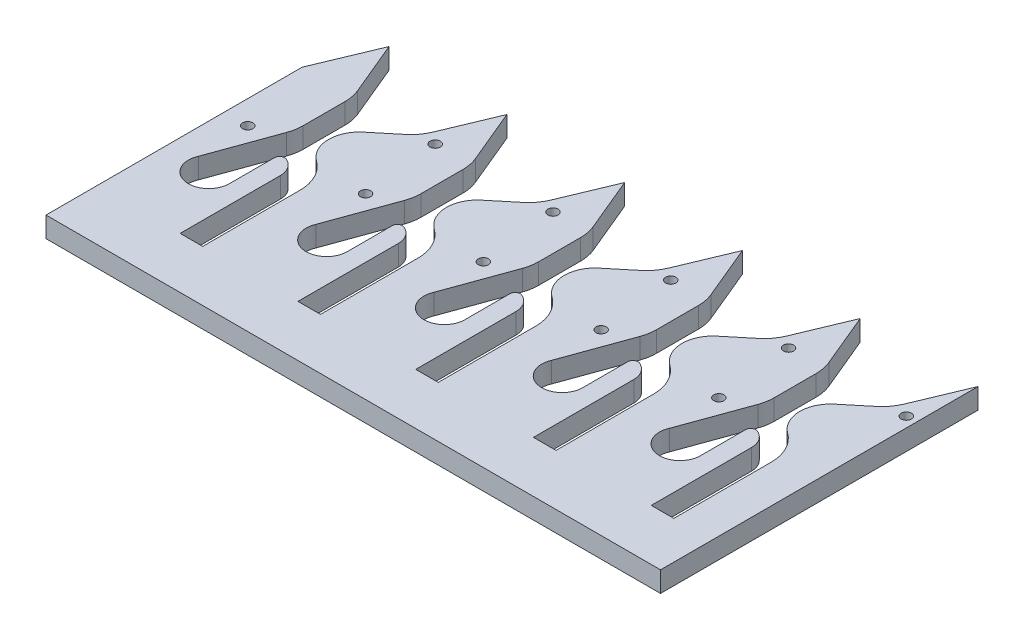
from build123d import *

# Parameters (mm, degrees)
SKETCH1_R           = 2.5
BOSS_EXTRUDE1_DEPTH = 10
FILLET1_R           = 20
FILLET2_R           = 2.5


with BuildPart() as part:
    # Sketch1 → Boss-Extrude1 (new body)
    with BuildSketch(Plane(origin=(0, 0, 0), x_dir=(1, 0, 0), z_dir=(0, 1, 0))):
        with BuildLine():
            Line((0, 0), (-300, 0))
            Line((-300, 0), (-300, 125))
            Line((-300, 125), (-287.5, 155))
            Line((-287.5, 155), (-275, 125))
            Line((-275, 125), (-275, 97))
            Line((-275, 97), (-287.66515139, 62))
            ThreePointArc((-287.66515139, 62), (-280.543096437, 48.210936871), (-268.5, 58))
            Line((-268.5, 58), (-268.5, 83))
            ThreePointArc((-268.5, 83), (-262.136038969, 80.363961031), (-259.5, 74))
            Line((-259.5, 74), (-259.5, 25))
            Line((-259.5, 25), (-248.5, 25))
            Line((-248.5, 25), (-248.5, 86.008335649))
            ThreePointArc((-248.5, 86.008335649), (-262.197622342, 96.159801673), (-257.553360344, 112.564311745))
            Line((-257.553360344, 112.564311745), (-242.5, 125))
            Line((-242.5, 125), (-230, 155))
            Line((-230, 155), (-217.5, 125))
            Line((-217.5, 125), (-217.5, 97))
            Line((-217.5, 97), (-230.16515139, 62))
            ThreePointArc((-230.16515139, 62), (-223.043096437, 48.210936871), (-211, 58))
            Line((-211, 58), (-211, 83))
            ThreePointArc((-211, 83), (-204.636038969, 80.363961031), (-202, 74))
            Line((-202, 74), (-202, 25))
            Line((-202, 25), (-191, 25))
            Line((-191, 25), (-191, 86.008335649))
            ThreePointArc((-191, 86.008335649), (-204.697622342, 96.159801673), (-200.053360344, 112.564311745))
            Line((-200.053360344, 112.564311745), (-185, 125))
            Line((-185, 125), (-172.5, 155))
            Line((-172.5, 155), (-160, 125))
            Line((-160, 125), (-160, 97))
            Line((-160, 97), (-172.66515139, 62))
            ThreePointArc((-172.66515139, 62), (-165.543096437, 48.210936871), (-153.5, 58))
            Line((-153.5, 58), (-153.5, 83))
            ThreePointArc((-153.5, 83), (-147.136038969, 80.363961031), (-144.5, 74))
            Line((-144.5, 74), (-144.5, 25))
            Line((-144.5, 25), (-133.5, 25))
            Line((-133.5, 25), (-133.5, 86.008335649))
            ThreePointArc((-133.5, 86.008335649), (-147.197622342, 96.159801673), (-142.553360344, 112.564311745))
            Line((-142.553360344, 112.564311745), (-127.5, 125))
            Line((-127.5, 125), (-115, 155))
            Line((-115, 155), (-102.5, 125))
            Line((-102.5, 125), (-102.5, 97))
            Line((-102.5, 97), (-115.16515139, 62))
            ThreePointArc((-115.16515139, 62), (-108.043096437, 48.210936871), (-96, 58))
            Line((-96, 58), (-96, 83))
            ThreePointArc((-96, 83), (-89.636038969, 80.363961031), (-87, 74))
            Line((-87, 74), (-87, 25))
            Line((-87, 25), (-76, 25))
            Line((-76, 25), (-76, 86.008335649))
            ThreePointArc((-76, 86.008335649), (-89.697622342, 96.159801673), (-85.053360344, 112.564311745))
            Line((-85.053360344, 112.564311745), (-70, 125))
            Line((-70, 125), (-57.5, 155))
            Line((-57.5, 155), (-45, 125))
            Line((-45, 125), (-45, 97))
            Line((-45, 97), (-57.66515139, 62))
            ThreePointArc((-57.66515139, 62), (-50.543096437, 48.210936871), (-38.5, 58))
            Line((-38.5, 58), (-38.5, 83))
            ThreePointArc((-38.5, 83), (-32.136038969, 80.363961031), (-29.5, 74))
            Line((-29.5, 74), (-29.5, 25))
            Line((-29.5, 25), (-18.5, 25))
            Line((-18.5, 25), (-18.5, 86.008335649))
            ThreePointArc((-18.5, 86.008335649), (-32.197622342, 96.159801673), (-27.553360344, 112.564311745))
            Line((-27.553360344, 112.564311745), (-12.5, 125))
            Line((-12.5, 125), (0, 155))
            Line((0, 155), (0, 0))
        make_face()
        with Locations(Location((-5, 125, 0), (0, 0, 270))):
            Circle(SKETCH1_R, mode=Mode.SUBTRACT)
        with Locations(Location((-58.5, 87, 0), (0, 0, 270))):
            Circle(SKETCH1_R, mode=Mode.SUBTRACT)
        with Locations(Location((-62.5, 125, 0), (0, 0, 270))):
            Circle(SKETCH1_R, mode=Mode.SUBTRACT)
        with Locations(Location((-116, 87, 0), (0, 0, 270))):
            Circle(SKETCH1_R, mode=Mode.SUBTRACT)
        with Locations(Location((-120, 125, 0), (0, 0, 270))):
            Circle(SKETCH1_R, mode=Mode.SUBTRACT)
        with Locations(Location((-173.5, 87, 0), (0, 0, 270))):
            Circle(SKETCH1_R, mode=Mode.SUBTRACT)
        with Locations(Location((-177.5, 125, 0), (0, 0, 270))):
            Circle(SKETCH1_R, mode=Mode.SUBTRACT)
        with Locations(Location((-231, 87, 0), (0, 0, 270))):
            Circle(SKETCH1_R, mode=Mode.SUBTRACT)
        with Locations(Location((-235, 125, 0), (0, 0, 270))):
            Circle(SKETCH1_R, mode=Mode.SUBTRACT)
        with Locations(Location((-288.5, 87, 0), (0, 0, 270))):
            Circle(SKETCH1_R, mode=Mode.SUBTRACT)
    extrude(amount=BOSS_EXTRUDE1_DEPTH)

    # Fillet1
    fillet1_edges = [part.edges().sort_by_distance(p)[0] for p in [
        (-275, 5, -125),
        (-275, 5, -97),
        (-248.5, 5, -86.008335649),
        (-242.5, 5, -125),
        (-217.5, 5, -125),
        (-217.5, 5, -97),
        (-191, 5, -86.008335649),
        (-185, 5, -125),
        (-160, 5, -125),
        (-160, 5, -97),
        (-133.5, 5, -86.008335649),
        (-127.5, 5, -125),
        (-102.5, 5, -125),
        (-102.5, 5, -97),
        (-76, 5, -86.008335649),
        (-70, 5, -125),
        (-45, 5, -125),
        (-45, 5, -97),
        (-18.5, 5, -86.008335649),
        (-12.5, 5, -125),
    ]]
    fillet(fillet1_edges, radius=FILLET1_R)

    # Fillet2
    fillet2_edges = [part.edges().sort_by_distance(p)[0] for p in [
        (-268.5, 5, -83),
        (-211, 5, -83),
        (-153.5, 5, -83),
        (-96, 5, -83),
        (-38.5, 5, -83),
    ]]
    fillet(fillet2_edges, radius=FILLET2_R)


solid = part.part
